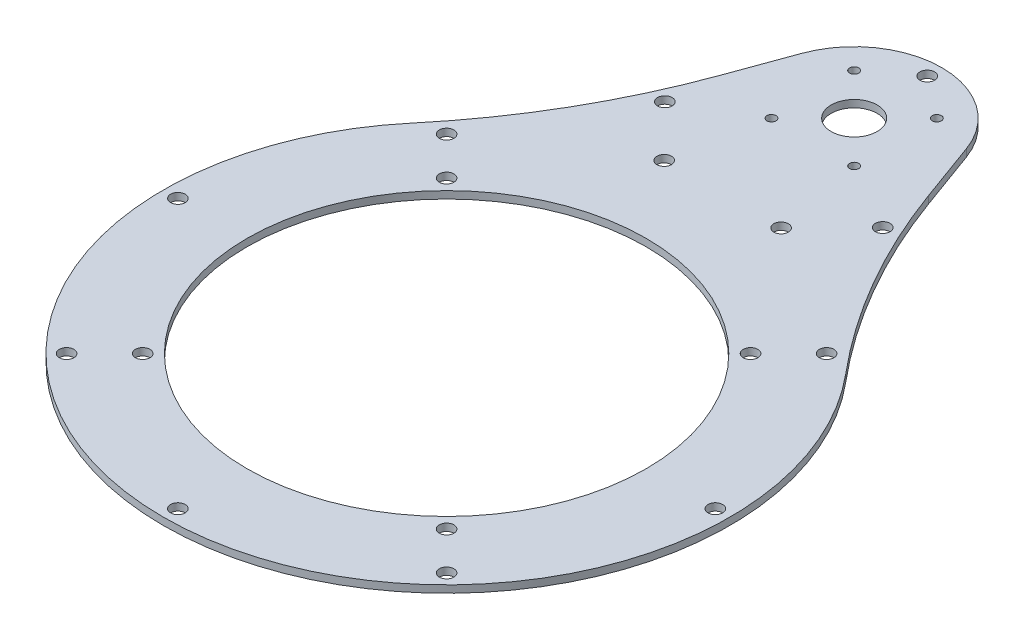
from build123d import *

# Parameters (mm, degrees)
SKETCH1_R           = 1.984375
SKETCH1_R_2         = 3.175
SKETCH1_R_3         = 10.0000054
SKETCH1_R_4         = 86.7075
BOSS_EXTRUDE1_DEPTH = 3.175


with BuildPart() as part:
    # Sketch1 → Boss-Extrude1 (new body)
    with BuildSketch(Plane.XZ.offset(64.8)):
        with BuildLine():
            ThreePointArc((-35.802288852, -190.105967461), (0, -215.175), (35.802288852, -190.105967461))
            Line((35.802288852, -190.105967461), (45.31324895, -163.974819355))
            ThreePointArc((45.31324895, -163.974819355), (66.095055559, -119.40809126), (94.300070948, -79.127154752))
            ThreePointArc((94.300070948, -79.127154752), (0, 123.1), (-94.300070948, -79.127154752))
            ThreePointArc((-94.300070948, -79.127154752), (-66.095055559, -119.40809126), (-45.31324895, -163.974819355))
            Line((-45.31324895, -163.974819355), (-35.802288852, -190.105967461))
        make_face()
        with Locations(Location((-17.960512242, -195.035512242, 0), (0, 0, 270))):
            Circle(SKETCH1_R, mode=Mode.SUBTRACT)
        with Locations(Location((-47.329330924, -142.15, 0), (0, 0, 270))):
            Circle(SKETCH1_R_2, mode=Mode.SUBTRACT)
        with Locations(Location((-17.960512242, -159.114487758, 0), (0, 0, 270))):
            Circle(SKETCH1_R, mode=Mode.SUBTRACT)
        with Locations(Location((-82.554716704, -82.554716704, 0), (0, 0, 270))):
            Circle(SKETCH1_R_2, mode=Mode.SUBTRACT)
        with Locations(Location((-25.4, -119.925, 0), (0, 0, 270))):
            Circle(SKETCH1_R_2, mode=Mode.SUBTRACT)
        with Locations(Location((0, -208.825, 0), (0, 0, 270))):
            Circle(SKETCH1_R_2, mode=Mode.SUBTRACT)
        with Locations(Location((17.960512242, -195.035512242, 0), (0, 0, 270))):
            Circle(SKETCH1_R, mode=Mode.SUBTRACT)
        with Locations(Location((0, -177.075, 0), (0, 0, 270))):
            Circle(SKETCH1_R_3, mode=Mode.SUBTRACT)
        with Locations(Location((17.960512242, -159.114487758, 0), (0, 0, 270))):
            Circle(SKETCH1_R, mode=Mode.SUBTRACT)
        with Locations(Location((47.329330924, -142.15, 0), (0, 0, 270))):
            Circle(SKETCH1_R_2, mode=Mode.SUBTRACT)
        with Locations(Location((25.4, -119.925, 0), (0, 0, 270))):
            Circle(SKETCH1_R_2, mode=Mode.SUBTRACT)
        with Locations(Location((82.554716704, -82.554716704, 0), (0, 0, 270))):
            Circle(SKETCH1_R_2, mode=Mode.SUBTRACT)
        with Locations(Location((-116.75, 0, 0), (0, 0, 270))):
            Circle(SKETCH1_R_2, mode=Mode.SUBTRACT)
        with Locations(Location((-82.554716704, 82.554716704, 0), (0, 0, 270))):
            Circle(SKETCH1_R_2, mode=Mode.SUBTRACT)
        with Locations(Location((0, 116.75, 0), (0, 0, 270))):
            Circle(SKETCH1_R_2, mode=Mode.SUBTRACT)
        with Locations(Location((116.75, 0, 0), (0, 0, 270))):
            Circle(SKETCH1_R_2, mode=Mode.SUBTRACT)
        with Locations(Location((82.554716704, 82.554716704, 0), (0, 0, 270))):
            Circle(SKETCH1_R_2, mode=Mode.SUBTRACT)
        with Locations(Location((66.026095693, 66.026095693, 0), (0, 0, 270))):
            Circle(SKETCH1_R_2, mode=Mode.SUBTRACT)
        with Locations(Location((-66.026095693, -66.026095693, 0), (0, 0, 270))):
            Circle(SKETCH1_R_2, mode=Mode.SUBTRACT)
        with Locations(Location((66.026095693, -66.026095693, 0), (0, 0, 270))):
            Circle(SKETCH1_R_2, mode=Mode.SUBTRACT)
        with Locations(Location((-66.026095693, 66.026095693, 0), (0, 0, 270))):
            Circle(SKETCH1_R_2, mode=Mode.SUBTRACT)
        with Locations(Location((0, 0, 0), (0, 0, 270))):
            Circle(SKETCH1_R_4, mode=Mode.SUBTRACT)
    extrude(amount=BOSS_EXTRUDE1_DEPTH)


solid = part.part
